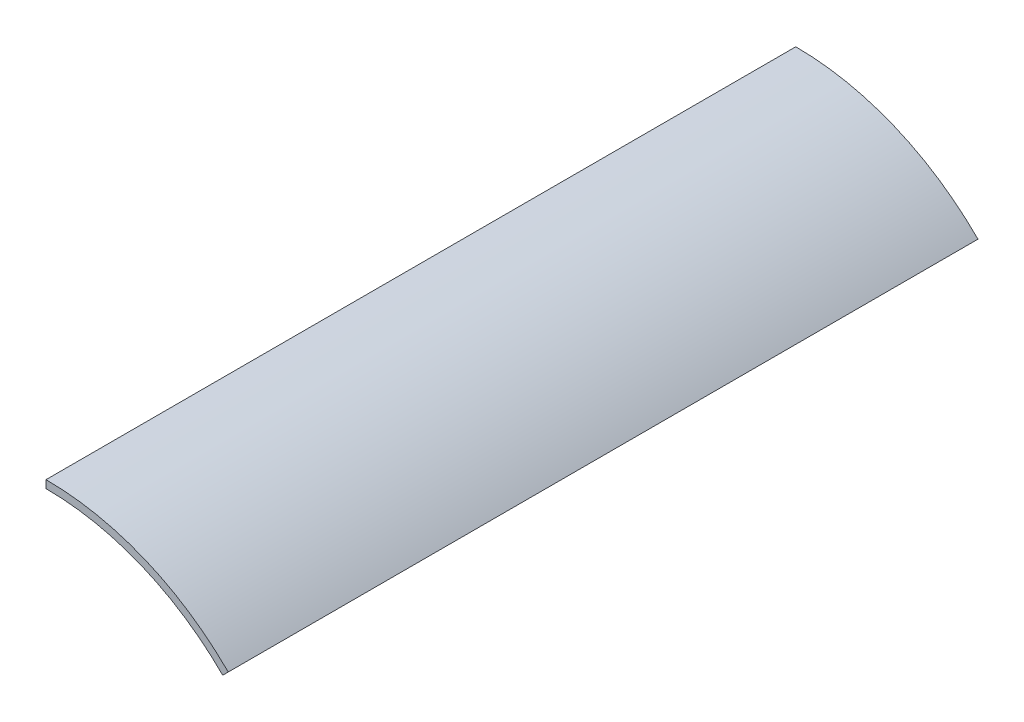
from build123d import *

# Parameters (mm, degrees)
BOSS_EXTRUDE1_DEPTH      = 152.4
BOSS_EXTRUDE1_DEPTH_BACK = 152.4


with BuildPart() as part:
    # Sketch1 → Boss-Extrude1 (new, two sides: drawn at the far end of the back side and taken through both)
    with BuildSketch(Plane.XY.offset(-BOSS_EXTRUDE1_DEPTH_BACK)):
        with BuildLine():
            Line((0, 104.775), (0, 101.6))
            ThreePointArc((0, 101.6), (38.880636728, 93.866160503), (71.842048969, 71.842048969))
            Line((71.842048969, 71.842048969), (74.087112999, 74.087112999))
            ThreePointArc((74.087112999, 74.087112999), (40.095656626, 96.799478019), (0, 104.775))
        make_face()
    extrude(amount=BOSS_EXTRUDE1_DEPTH + BOSS_EXTRUDE1_DEPTH_BACK)


solid = part.part
